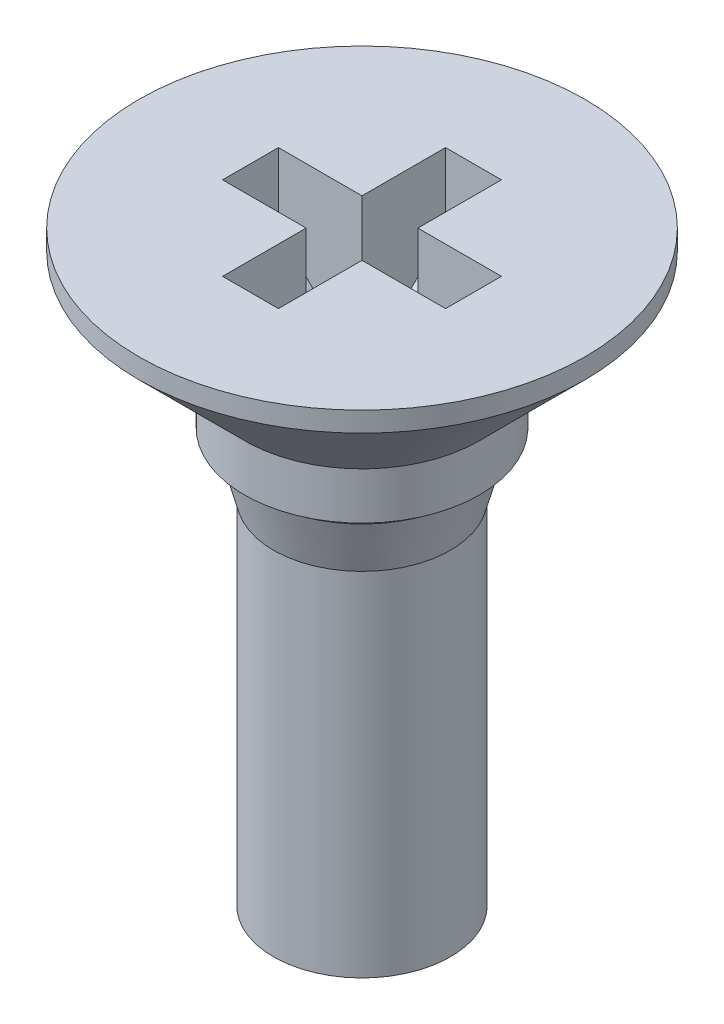
from build123d import *

# Parameters (mm, degrees)
KREUZSCHLITZ1_H_DEPTH      = 0.238
KREUZSCHLITZ1_H_DEPTH_BACK = 0.238
KREUZSCHLITZ2_H_DEPTH      = 0.238
KREUZSCHLITZ2_H_DEPTH_BACK = 0.238


with BuildPart() as part:
    # Skizze1 → Basis-Rotation (revolve)
    with BuildSketch(Plane.XY, mode=Mode.PRIVATE) as basis_rotation_sk:
        Polygon((0, 0), (1.9, 0), (1.9, -0.17), (1, -1.07), (1, -1.47), (0.87, -1.47), (0.87, -1.568948132), (0.7545, -2), (0.7545, -5), (0, -5), align=None)
    revolve(basis_rotation_sk.sketch.rotate(Axis((0, 0, 0), (0, -1, 0)), 180), axis=Axis((0, 0, 0), (0, -1, 0)))

    # Skizze2 → Kreuzschlitz1 H (cut, two sides: drawn at the far end of the back side and taken through both)
    with BuildSketch(Plane.XY.offset(-KREUZSCHLITZ1_H_DEPTH_BACK)):
        Polygon((-0.35, -1.2), (0.35, -1.2), (0.95, -0.6), (0.95, 0), (-0.95, 0), (-0.95, -0.6), align=None)
    extrude(amount=KREUZSCHLITZ1_H_DEPTH + KREUZSCHLITZ1_H_DEPTH_BACK, mode=Mode.SUBTRACT)

    # Skizze3 → Kreuzschlitz2 H (cut, two sides: drawn at the far end of the back side and taken through both)
    with BuildSketch(Plane(origin=(0, 0, 0), x_dir=(0, 0, -1), z_dir=(1, 0, 0)).offset(-KREUZSCHLITZ2_H_DEPTH_BACK)):
        Polygon((-0.35, -1.2), (0.35, -1.2), (0.95, -0.6), (0.95, 0), (-0.95, 0), (-0.95, -0.6), align=None)
    extrude(amount=KREUZSCHLITZ2_H_DEPTH + KREUZSCHLITZ2_H_DEPTH_BACK, mode=Mode.SUBTRACT)


solid = part.part
